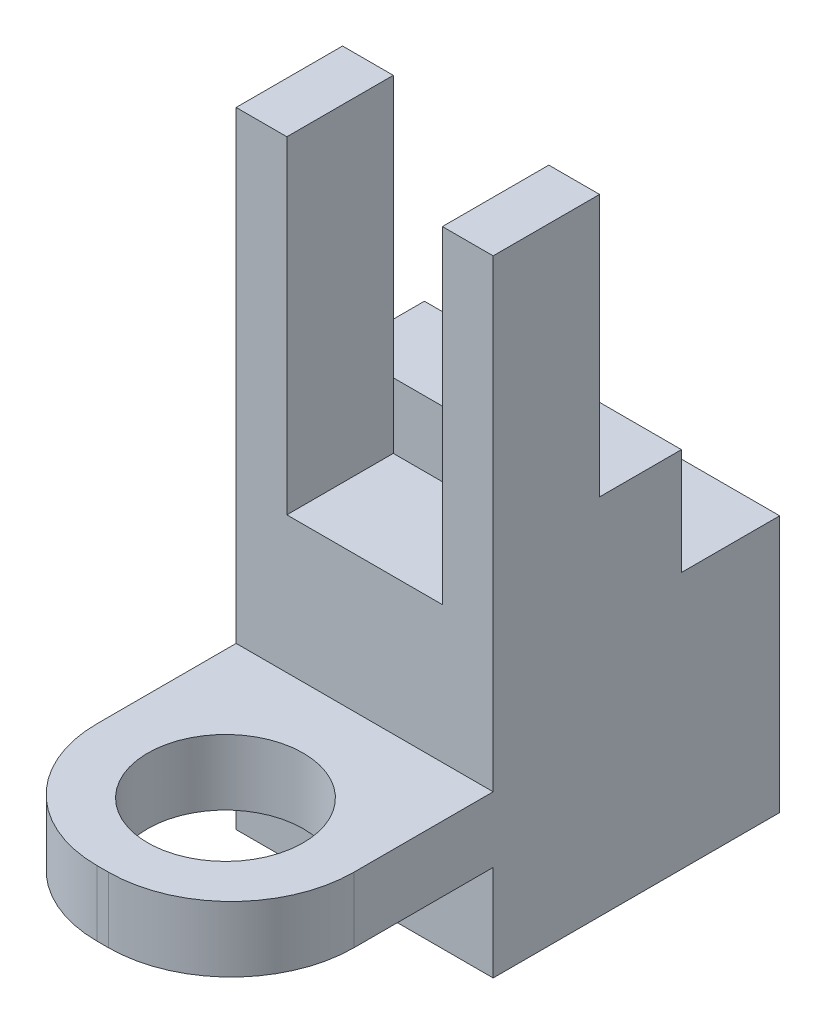
from build123d import *

# Parameters (mm, degrees)
SKETCH4_W            = 31.4
SKETCH4_H            = 31.4
SKETCH4_W_2          = 25.4
SKETCH4_H_2          = 25.4
BOSS_EXTRUDE3_DEPTH  = 30
SKETCH5_W            = 31.4
SKETCH5_H            = 31.4
BOSS_EXTRUDE4_DEPTH  = 5
SKETCH6_W            = 31.4
SKETCH6_H            = 8
BOSS_EXTRUDE5_DEPTH  = 5
BOSS_EXTRUDE6_DEPTH  = 8
SKETCH8_R            = 9.5
BOSS_EXTRUDE7_DEPTH  = 8
SKETCH9_W            = 31.4
SKETCH9_H            = 10
BOSS_EXTRUDE8_DEPTH  = 5
SKETCH10_W           = 31.4
SKETCH10_H           = 10
BOSS_EXTRUDE9_DEPTH  = 13
SKETCH11_W           = 6.2
SKETCH11_H           = 10
BOSS_EXTRUDE10_DEPTH = 40
BOSS_EXTRUDE11_DEPTH = 3
CUT_EXTRUDE1_START   = 8
SKETCH8_2_R          = 9.5
CUT_EXTRUDE1_DEPTH   = 24


with BuildPart() as part:
    # Sketch4 → Boss-Extrude3 (new body)
    with BuildSketch(Plane.XY):
        Rectangle(SKETCH4_W, SKETCH4_H)
        Rectangle(SKETCH4_W_2, SKETCH4_H_2, mode=Mode.SUBTRACT)
    extrude(amount=BOSS_EXTRUDE3_DEPTH)

    # Sketch5 → Boss-Extrude4 (add)
    with BuildSketch(Plane.XY.offset(30)):
        Rectangle(SKETCH5_W, SKETCH5_H)
    extrude(amount=BOSS_EXTRUDE4_DEPTH)

    # Sketch6 → Boss-Extrude5 (add)
    with BuildSketch(Plane.XY.offset(35)):
        Rectangle(SKETCH6_W, SKETCH6_H)
    extrude(amount=BOSS_EXTRUDE5_DEPTH)

    # Sketch7 → Boss-Extrude6 (add)
    with BuildSketch(Plane.XZ.offset(4)):
        with BuildLine():
            Line((-15.7, 40), (-15.7, 52))
            ThreePointArc((-15.7, 52), (-11.306601718, 62.606601718), (-0.7, 67))
            Line((-0.7, 67), (0.7, 67))
            ThreePointArc((0.7, 67), (11.306601718, 62.606601718), (15.7, 52))
            Line((15.7, 52), (15.7, 40))
            Line((15.7, 40), (-15.7, 40))
        make_face()
    extrude(amount=-BOSS_EXTRUDE6_DEPTH)

    # Sketch8 → Boss-Extrude7 (add)
    with BuildSketch(Plane.XZ.offset(4)):
        with Locations((0, 52)):
            Circle(SKETCH8_R)
    boss_extrude7 = extrude(amount=BOSS_EXTRUDE7_DEPTH)

    # Mirror1: Boss-Extrude7 across plane
    add(boss_extrude7.mirror(Plane.ZX))

    # Sketch9 → Boss-Extrude8 (add)
    with BuildSketch(Plane(origin=(0, 15.7, 0), x_dir=(1, 0, 0), z_dir=(0, 1, 0))):
        with Locations((0, -27)):
            Rectangle(SKETCH9_W, SKETCH9_H)
    extrude(amount=BOSS_EXTRUDE8_DEPTH)

    # Sketch10 → Boss-Extrude9 (add)
    with BuildSketch(Plane(origin=(0, 15.7, 0), x_dir=(1, 0, 0), z_dir=(0, 1, 0))):
        with Locations((0, -17)):
            Rectangle(SKETCH10_W, SKETCH10_H)
    extrude(amount=BOSS_EXTRUDE9_DEPTH)

    # Sketch11 → Boss-Extrude10 (add)
    with BuildSketch(Plane(origin=(0, 20.7, 0), x_dir=(1, 0, 0), z_dir=(0, 1, 0))):
        with Locations((-12.6, -27)):
            Rectangle(SKETCH11_W, SKETCH11_H)
        with Locations((12.6, -27)):
            Rectangle(SKETCH11_W, SKETCH11_H)
    extrude(amount=BOSS_EXTRUDE10_DEPTH)

    # Sketch12 → Boss-Extrude11 (add)
    with BuildSketch(Plane.XY.offset(32)):
        Polygon((-15.7, 60.7), (-9.5, 60.7), (-9.5, 20.7), (9.5, 20.7), (9.5, 60.7), (15.7, 60.7), (15.7, 15.7), (-15.7, 15.7), align=None)
    extrude(amount=BOSS_EXTRUDE11_DEPTH)

    # Sketch8<2> → Cut-Extrude1 (cut)
    with BuildSketch(Plane.XZ.offset(4).offset(CUT_EXTRUDE1_START)):
        with Locations((0, 52)):
            Circle(SKETCH8_2_R)
    extrude(amount=-CUT_EXTRUDE1_DEPTH, mode=Mode.SUBTRACT)


solid = part.part
